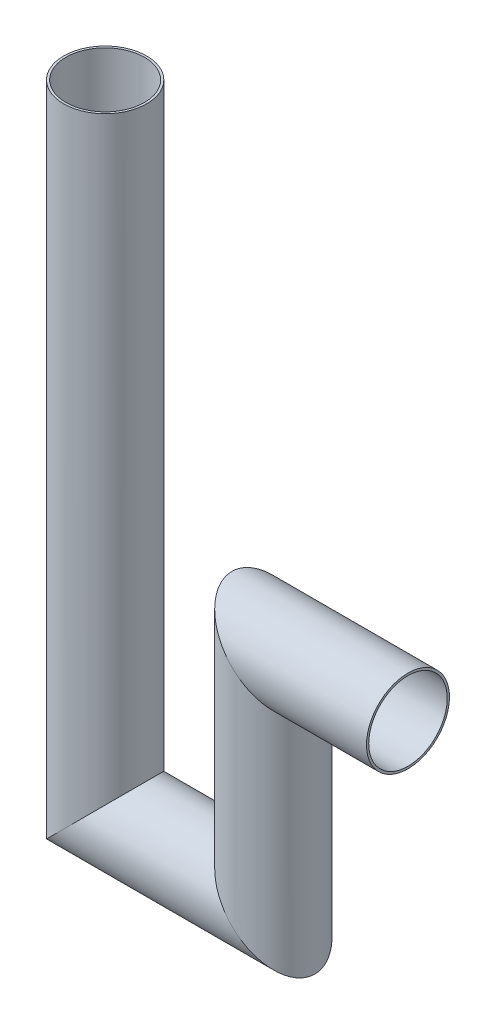
from build123d import *

# Parameters (mm, degrees)
SKETCH1_R   = 46.99
SKETCH1_R_2 = 44.45


with BuildPart() as part:
    # Sweep2: sweep along a curve in space
    with BuildLine() as sweep2_path:
        Line((0, 0, 0), (0, -711.2, 0))
        Line((0, -711.2, 0), (190.5, -711.2, 0))
        Line((190.5, -711.2, 0), (190.5, -457.2, 0))
        Line((190.5, -457.2, 0), (342.9, -457.2, 0))
    # Sketch1 → Sweep2 (sweep)
    with BuildSketch(Plane(origin=(0, 0, 0), x_dir=(1, 0, 0), z_dir=(0, 1, 0))):
        Circle(SKETCH1_R)
        Circle(SKETCH1_R_2, mode=Mode.SUBTRACT)
    sweep(path=sweep2_path.line, transition=Transition.RIGHT)


solid = part.part
